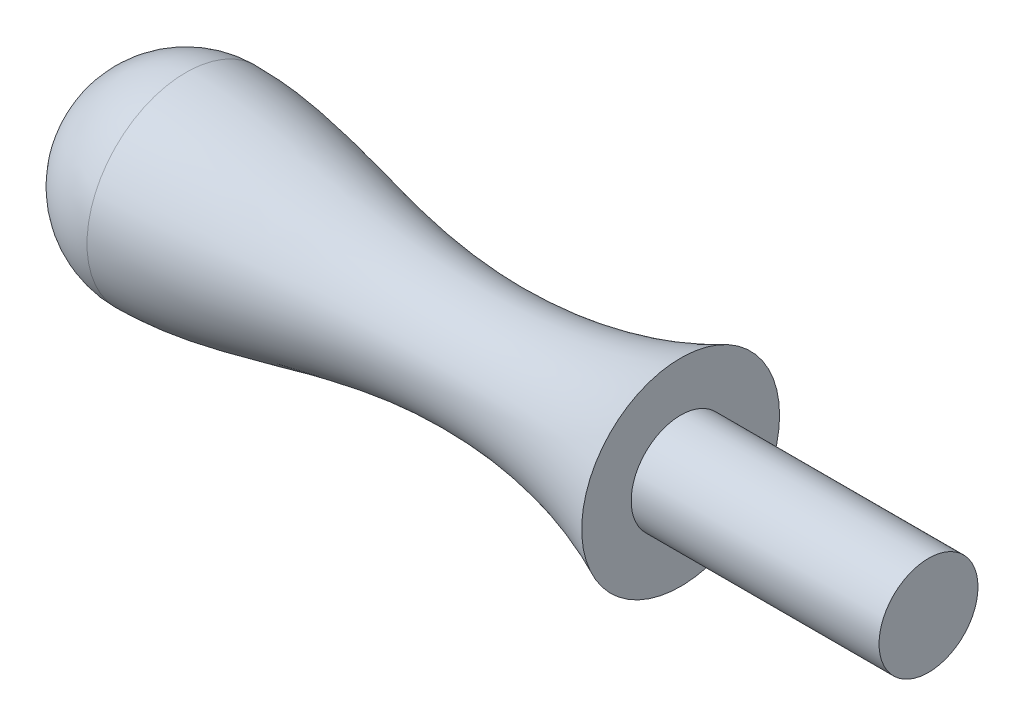
from build123d import *

# Parameters (mm, degrees)
SKETCH2_R           = 3.175
BOSS_EXTRUDE1_DEPTH = 15.909119187


with BuildPart() as part:
    # Sketch1 → Revolve1 (revolve)
    with BuildSketch(Plane(origin=(0, 0, 0), x_dir=(1, 0, 0), z_dir=(0, 1, 0))):
        with BuildLine():
            Line((0, 6.35), (0, 0))
            Line((0, 0), (-31.75, 0))
            Line((-31.75, 0), (-38.1, 0))
            ThreePointArc((-38.1, 0), (-36.240128061, 4.490128061), (-31.75, 6.35))
            add(Edge.make_bspline(
                [(0, 6.35), (-5.750171966, 3.663051231), (-16.893720994, 2.763594688), (-27.170516241, 6.35), (-31.75, 6.35)],
                knots=[0, 0, 0, 0, 0.579529836, 1, 1, 1, 1], degree=3))
        make_face()
    revolve(axis=Axis((0, 0, 0), (-1, 0, 0)))

    # Sketch2 → Boss-Extrude1 (add)
    with BuildSketch(Plane(origin=(0, 0, 0), x_dir=(0, 0, -1), z_dir=(1, 0, 0))):
        Circle(SKETCH2_R)
    extrude(amount=BOSS_EXTRUDE1_DEPTH)


solid = part.part
